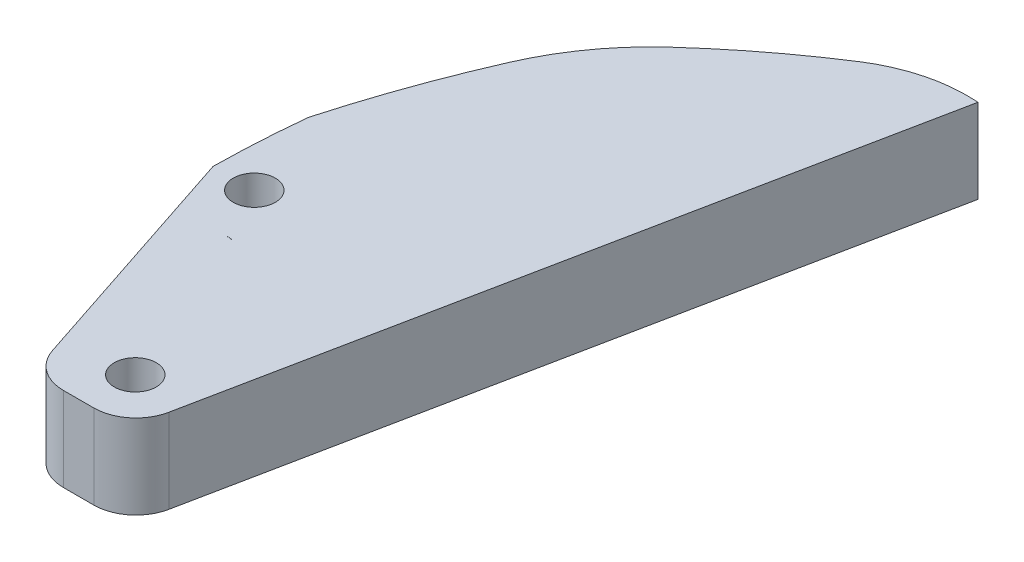
from build123d import *

# Parameters (mm, degrees)
SKETCH2_R           = 1
BOSS_EXTRUDE2_DEPTH = 4
FILLET1_R           = 13
FILLET2_R           = 7
FILLET4_R           = 7


with BuildPart() as part:
    # Sketch2 → Boss-Extrude2 (new body)
    with BuildSketch(Plane(origin=(0, 0, 0), x_dir=(1, 0, 0), z_dir=(0, 1, 0))):
        with BuildLine():
            Line((-5.254491041, 13.546811275), (-1.48741211, 2.139537078))
            ThreePointArc((-1.48741211, 2.139537078), (-0.759971379, 1.145843389), (0.411712444, 0.766694098))
            Line((0.411712444, 0.766694098), (1.855419889, 0.766694098))
            ThreePointArc((1.855419889, 0.766694098), (3.121752187, 1.218662279), (3.815742579, 2.370291586))
            Line((3.815742579, 2.370291586), (10.286953209, 34.372260906))
            ThreePointArc((10.286953209, 34.372260906), (9.271638883, 34.372242241), (8.262186146, 34.263300263))
            ThreePointArc((8.262186146, 34.263300263), (7.370397326, 33.984118682), (6.494594719, 33.658236114))
            ThreePointArc((6.494594719, 33.658236114), (2.361803433, 30.744474886), (-1.353992878, 27.314777221))
            ThreePointArc((-1.353992878, 27.314777221), (-3.406730235, 22.664628668), (-5.003894853, 17.839001517))
            ThreePointArc((-5.003894853, 17.839001517), (-5.179724164, 15.695856621), (-5.254491041, 13.546811275))
        make_face()
        with Locations(Location((1.478658486, 3.11569661, 0), (0, 0, 270))):
            Circle(SKETCH2_R, mode=Mode.SUBTRACT)
        with Locations(Location((-3.294171009, 13.546811275, 0), (0, 0, 270))):
            Circle(SKETCH2_R, mode=Mode.SUBTRACT)
        with BuildLine():
            ThreePointArc((-1.76086985, 10.970987524), (-1.889568474, 10.993883735), (-2.020154104, 10.999796885))
            ThreePointArc((-2.020154104, 10.999796885), (-1.890628473, 10.984343745), (-1.76086985, 10.970987524))
        make_face(mode=Mode.SUBTRACT)
    extrude(amount=BOSS_EXTRUDE2_DEPTH)

    # Fillet1
    fillet1_edges = [part.edges().sort_by_distance(p)[0] for p in [
        (-1.353992878, 2, -27.314777221),
    ]]
    fillet(fillet1_edges, radius=FILLET1_R)

    # Fillet2
    fillet2_edges = [part.edges().sort_by_distance(p)[0] for p in [
        (8.262186146, 2, -34.263300263),
    ]]
    fillet(fillet2_edges, radius=FILLET2_R)

    # Fillet4
    fillet4_edges = [part.edges().sort_by_distance(p)[0] for p in [
        (6.494594719, 2, -33.658236114),
    ]]
    fillet(fillet4_edges, radius=FILLET4_R)


solid = part.part
